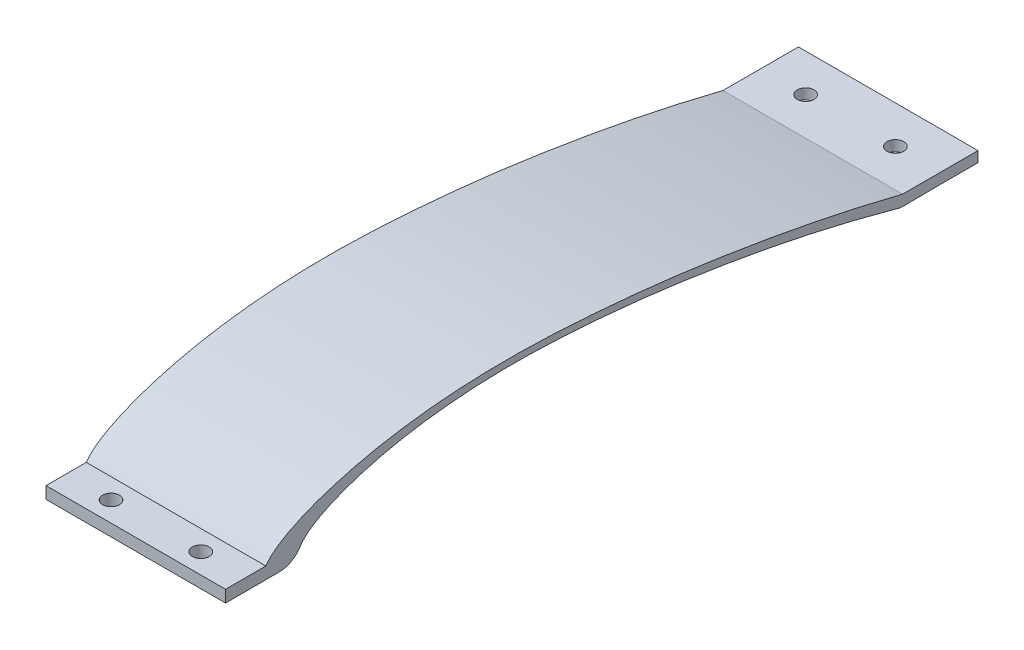
from build123d import *

# Parameters (mm, degrees)
BOSS_EXTRUDE1_DEPTH     = 38.1
SKETCH3_R               = 1.778
CUT_EXTRUDE1_DEPTH      = 38.1
CUT_EXTRUDE3_DEPTH      = 11.938
CUT_EXTRUDE3_DEPTH_BACK = 28.448
SKETCH4_R               = 1.778
BODY_MOVE_COPY1_ANGLE   = 180
FILLET1_R               = 5.08
FILLET2_R               = 5.08


with BuildPart() as part:
    # Sketch2 → Boss-Extrude1 (new body)
    with BuildSketch(Plane(origin=(0, 0, 0), x_dir=(0, 0, -1), z_dir=(1, 0, 0))):
        with BuildLine():
            Line((61.551687437, -3.321105161), (69.171687437, -3.321105161))
            Line((69.171687437, -3.321105161), (69.171687437, -0.781105161))
            Line((69.171687437, -0.781105161), (60.630976158, -0.781105161))
            add(Edge.make_bspline(
                [(-74.483124949, 0), (-74.29506702, 0.047278952), (-74.10698747, 0.094388678), (-70.904571083, 0.893531227), (-67.885219866, 1.606315794), (-61.837800978, 2.963660005), (-58.809532664, 3.606649181), (-52.743665837, 4.819598746), (-49.706033948, 5.389297888), (-43.622383657, 6.463053748), (-40.576470595, 6.967934975), (-34.476736535, 7.915800889), (-31.422723589, 8.357283165), (-22.245838635, 9.56552735), (-16.107570019, 10.211777803), (-3.79150253, 11.194869773), (2.387371081, 11.523299152), (11.712928825, 11.567860245), (14.83108155, 11.507311348), (19.526735057, 11.272277451), (21.09736044, 11.169754089), (24.233480366, 10.913630723), (25.796978104, 10.760219025), (28.914435137, 10.400395235), (30.468402117, 10.194025854), (33.566409835, 9.726131888), (35.110422635, 9.464452072), (39.7241769, 8.577816768), (42.774697618, 7.846061144), (47.306875011, 6.506143704), (48.811872451, 6.022443493), (51.760401832, 4.929089412), (53.207463955, 4.319622251), (55.32547656, 3.284052789), (56.022148657, 2.917322209), (57.045964203, 2.318308681), (57.384595606, 2.110148), (58.046935353, 1.675696382), (58.369940132, 1.448090073), (58.991074857, 0.961253421), (59.289298742, 0.702142505), (59.859060755, 0.149994367), (60.130661436, -0.142782581), (60.465730526, -0.558869775), (60.549947208, -0.668774479), (60.630976158, -0.781105161)],
                knots=[0.029299917, 0.029299917, 0.029299917, 0.029299917, 0.03125, 0.03125, 0.0625, 0.0625, 0.09375, 0.09375, 0.125, 0.125, 0.15625, 0.15625, 0.1875, 0.1875, 0.25, 0.25, 0.3125, 0.3125, 0.34375, 0.34375, 0.359375, 0.359375, 0.375, 0.375, 0.390625, 0.390625, 0.40625, 0.40625, 0.4375, 0.4375, 0.453125, 0.453125, 0.46875, 0.46875, 0.4765625, 0.4765625, 0.48046875, 0.48046875, 0.484375, 0.484375, 0.48828125, 0.48828125, 0.4921875, 0.4921875, 0.493552461, 0.493552461, 0.493552461, 0.493552461], degree=3))
            Line((-74.483124949, 0), (-90.499178662, 0))
            Line((-90.499178662, 0), (-90.499178662, -2.231815001))
            Line((-90.499178662, -2.231815001), (-82.946942991, -2.231815001))
            Line((-82.946942991, -2.231815001), (-73.650183958, -2.301897798))
            ThreePointArc((-73.650183958, -2.301897798), (-73.256112799, -2.103727422), (-72.839144435, -1.959849143))
            add(Edge.make_bspline(
                [(-72.839144435, -1.959849143), (-71.519290177, -1.601063172), (-70.199210435, -1.244042105), (-67.557002621, -0.546032536), (-66.234731433, -0.206164224), (-62.264239138, 0.784646761), (-59.612821841, 1.410572396), (-54.302332968, 2.602512538), (-51.643085198, 3.167147951), (-46.316396426, 4.232289177), (-43.648926114, 4.732565578), (-38.306620945, 5.675475048), (-35.631878593, 6.118832154), (-30.275449601, 6.951192452), (-27.593594404, 7.338876315), (-19.534991827, 8.399885551), (-14.144724046, 8.967384827), (-3.32947533, 9.830678583), (2.096449378, 10.119086016), (10.285607687, 10.158216956), (13.023786679, 10.105046463), (17.147234411, 9.898653467), (18.52646558, 9.808623459), (21.280422314, 9.583710928), (22.653394403, 9.448993765), (25.390962478, 9.1330176), (26.755565214, 8.951796103), (29.476054041, 8.540919041), (30.831915599, 8.311127162), (34.883444217, 7.532535997), (37.562232743, 6.88995109), (41.542125332, 5.713314117), (42.863725887, 5.288556937), (45.452951599, 4.328437457), (46.723676753, 3.793239112), (48.583591302, 2.883862698), (49.195367911, 2.561821393), (50.094422725, 2.035802816), (50.391788978, 1.853008305), (50.973416929, 1.471498355), (51.257060798, 1.271627832), (51.802504913, 0.844116414), (52.064387652, 0.616580392), (52.564719262, 0.131716255), (52.803223064, -0.125383304), (53.239315406, -0.66692069), (53.439034885, -0.953227075), (53.77549654, -1.567845752), (53.908977144, -1.889194183), (54.024229, -2.404662563), (54.047066399, -2.577492013), (54.056805302, -2.922141279), (54.04379582, -3.096126776), (54.011875168, -3.264266952)],
                knots=[0, 0, 0, 0, 0.015625, 0.015625, 0.03125, 0.03125, 0.0625, 0.0625, 0.09375, 0.09375, 0.125, 0.125, 0.15625, 0.15625, 0.1875, 0.1875, 0.25, 0.25, 0.3125, 0.3125, 0.34375, 0.34375, 0.359375, 0.359375, 0.375, 0.375, 0.390625, 0.390625, 0.40625, 0.40625, 0.4375, 0.4375, 0.453125, 0.453125, 0.46875, 0.46875, 0.4765625, 0.4765625, 0.48046875, 0.48046875, 0.484375, 0.484375, 0.48828125, 0.48828125, 0.4921875, 0.4921875, 0.49609375, 0.49609375, 0.5, 0.5, 0.501953125, 0.501953125, 0.503868919, 0.503868919, 0.503868919, 0.503868919], degree=3))
            Line((54.011875168, -3.264266952), (61.551687437, -3.321105161))
        make_face()
    extrude(amount=BOSS_EXTRUDE1_DEPTH)

    # Sketch3 → Cut-Extrude1 (cut)
    with BuildSketch(Plane(origin=(0, -0.781105161, 0), x_dir=(1, 0, 0), z_dir=(0, 1, 0))):
        with BuildLine():
            ThreePointArc((11.303, 64.901331798), (9.525, 66.679331798), (7.747, 64.901331798))
            Line((7.747, 64.901331798), (11.303, 64.901331798))
        make_face()
        with BuildLine():
            Line((11.303, 64.901331798), (7.747, 64.901331798))
            ThreePointArc((7.747, 64.901331798), (9.525, 63.123331798), (11.303, 64.901331798))
        make_face()
        with Locations(Location((28.575, 64.901331798, 0), (0, 0, 270))):
            Circle(SKETCH3_R)
    extrude(amount=-CUT_EXTRUDE1_DEPTH, mode=Mode.SUBTRACT)

    # Sketch4 → Cut-Extrude3 (cut, two sides: drawn at the far end of the back side and taken through both)
    with BuildSketch(Plane(origin=(0, -0.781105161, 0), x_dir=(1, 0, 0), z_dir=(0, 1, 0)).offset(-CUT_EXTRUDE3_DEPTH_BACK)):
        with Locations(Location((9.525, -82.491151805, 0), (0, 0, 90))):
            Circle(SKETCH4_R)
        with Locations(Location((28.575, -82.491151805, 0), (0, 0, 90))):
            Circle(SKETCH4_R)
    extrude(amount=CUT_EXTRUDE3_DEPTH + CUT_EXTRUDE3_DEPTH_BACK, mode=Mode.SUBTRACT)


with BuildPart() as part_1:
    # Body-Move/Copy1: moved
    add(part.part.rotate(Axis((19.05, 0, 10.663745612), (0, 1, 0)), BODY_MOVE_COPY1_ANGLE))

    # Fillet1
    fillet1_edges = [part_1.edges().sort_by_distance(p)[0] for p in [
        (19.05, -3.264266952, 75.339366393),
    ]]
    fillet(fillet1_edges, radius=FILLET1_R)

    # Fillet2
    fillet2_edges = [part_1.edges().sort_by_distance(p)[0] for p in [
        (19.05, -2.301897798, -52.322692734),
    ]]
    fillet(fillet2_edges, radius=FILLET2_R)


solid = part_1.part
